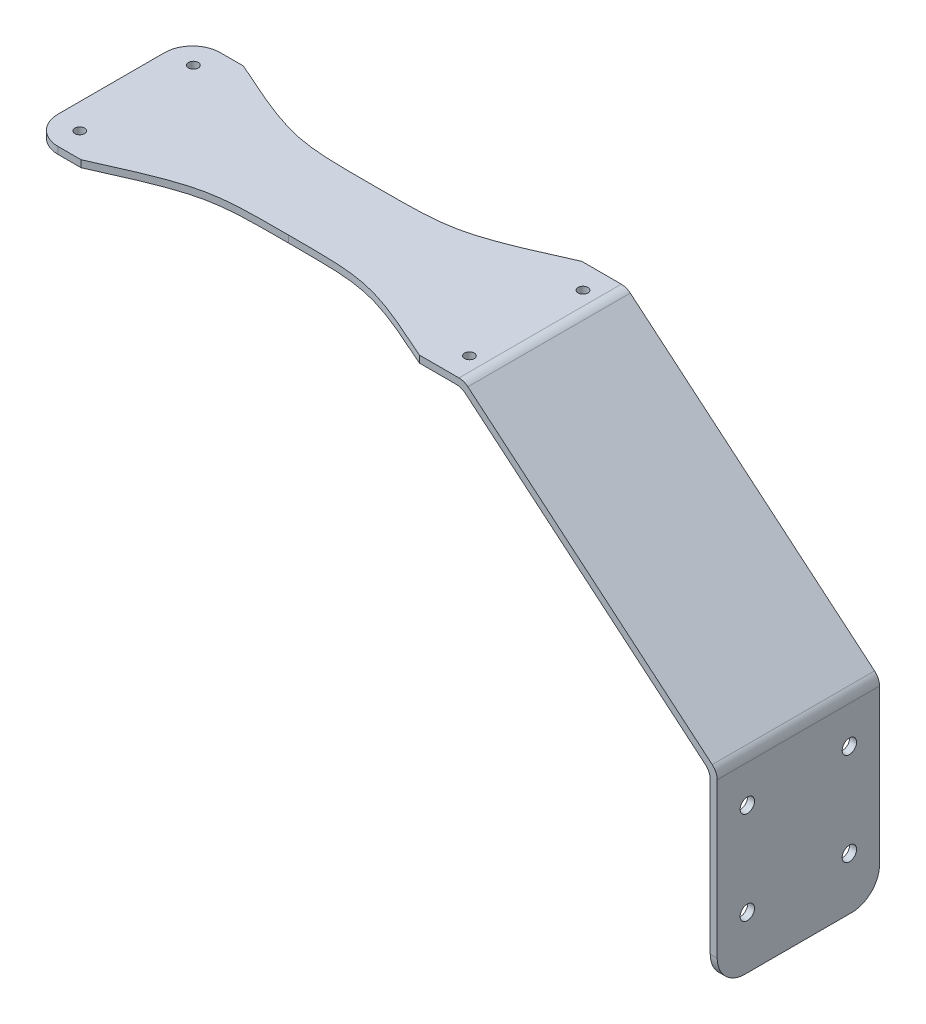
from build123d import *

# Parameters (mm, degrees)
EXTRUDE_1_DEPTH         = 35
FILLET_1_R              = 3
HOLE_WIZARD_2_1_2_1_1_D = 2.1
CUT_EXTRUDE_1_DEPTH     = 40
HOLE_WIZARD_3_1_3_1_1_D = 3.1
FILLET_2_R              = 6


with BuildPart() as part:
    # 草图2 → 凸台-拉伸1 (new body)
    with BuildSketch(Plane.XY):
        Polygon((63.67397579, 0.477588596), (63.67397579, -39.522411404), (65.17397579, -39.522411404), (65.17397579, 1.177050084), (10.596820123, 46.972721274), (-82.949135229, 46.972721274), (-82.949135229, 45.472721274), (10.050864771, 45.472721274), align=None)
    extrude(amount=EXTRUDE_1_DEPTH)

    # 圆角1
    fillet_1_edges = [part.edges().sort_by_distance(p)[0] for p in [
        (65.17397579, 1.177050084, 17.5),
        (63.67397579, 0.477588596, 17.5),
        (10.050864771, 45.472721274, 17.5),
        (10.596820123, 46.972721274, 17.5),
    ]]
    fillet(fillet_1_edges, radius=FILLET_1_R)

    # Ø2.1 (2.1) 直径孔1 (through all)
    with Locations(Plane(origin=(-77.49509058, 46.972721274, 5.25), x_dir=(1, 0, 0), z_dir=(0, 1, 0))):
        with Locations((0, 0), (0, -24.5), (84, 0), (84, -24.5)):
            Hole(HOLE_WIZARD_2_1_2_1_1_D / 2)

    # 草图5 → 切除-拉伸1 (cut)
    with BuildSketch(Plane(origin=(0, 46.972721274, 0), x_dir=(1, 0, 0), z_dir=(0, 1, 0))):
        with BuildLine():
            Line((-77.49509058, 2.502445458), (-77.49509058, 12.845233831))
            Line((-77.49509058, 12.845233831), (6.50490942, 12.845233831))
            Line((6.50490942, 12.845233831), (6.50490942, 2.502445458))
            add(Edge.make_bspline(
                [(6.50490942, 2.502445458), (-17.420246, -8.385701978), (-17.47591474, -8.300022399), (-35.49509058, -8.300022399)],
                knots=[0, 0, 0, 0, 1, 1, 1, 1], degree=3))
            add(Edge.make_bspline(
                [(-77.49509058, 2.502445458), (-53.56993516, -8.385701978), (-53.51426642, -8.300022399), (-35.49509058, -8.300022399)],
                knots=[0, 0, 0, 0, 1, 1, 1, 1], degree=3))
        make_face()
        with BuildLine():
            Line((-77.49509058, -37.502445458), (-77.49509058, -45.419140672))
            Line((-77.49509058, -45.419140672), (6.50490942, -45.419140672))
            Line((6.50490942, -45.419140672), (6.50490942, -37.502445458))
            add(Edge.make_bspline(
                [(6.50490942, -37.502445458), (-17.420246, -26.614298022), (-17.47591474, -26.699977601), (-35.49509058, -26.699977601)],
                knots=[0, 0, 0, 0, 1, 1, 1, 1], degree=3))
            add(Edge.make_bspline(
                [(-77.49509058, -37.502445458), (-53.56993516, -26.614298022), (-53.51426642, -26.699977601), (-35.49509058, -26.699977601)],
                knots=[0, 0, 0, 0, 1, 1, 1, 1], degree=3))
        make_face()
    extrude(amount=-CUT_EXTRUDE_1_DEPTH, mode=Mode.SUBTRACT)

    # Ø3.1 (3.1) 直径孔1 (through all)
    with Locations(Plane(origin=(65.17397579, -8.221872891, 28.5), x_dir=(0, 1, 0), z_dir=(1, 0, 0))):
        with Locations((0, 0), (0, -22), (-20, -22), (-20, 0)):
            Hole(HOLE_WIZARD_3_1_3_1_1_D / 2)

    # 圆角2
    fillet_2_edges = [part.edges().sort_by_distance(p)[0] for p in [
        (-82.949135229, 46.222721274, 35),
        (64.42397579, -39.522411404, 35),
        (64.42397579, -39.522411404, 0),
        (-82.949135229, 46.222721274, 0),
    ]]
    fillet(fillet_2_edges, radius=FILLET_2_R)


solid = part.part
